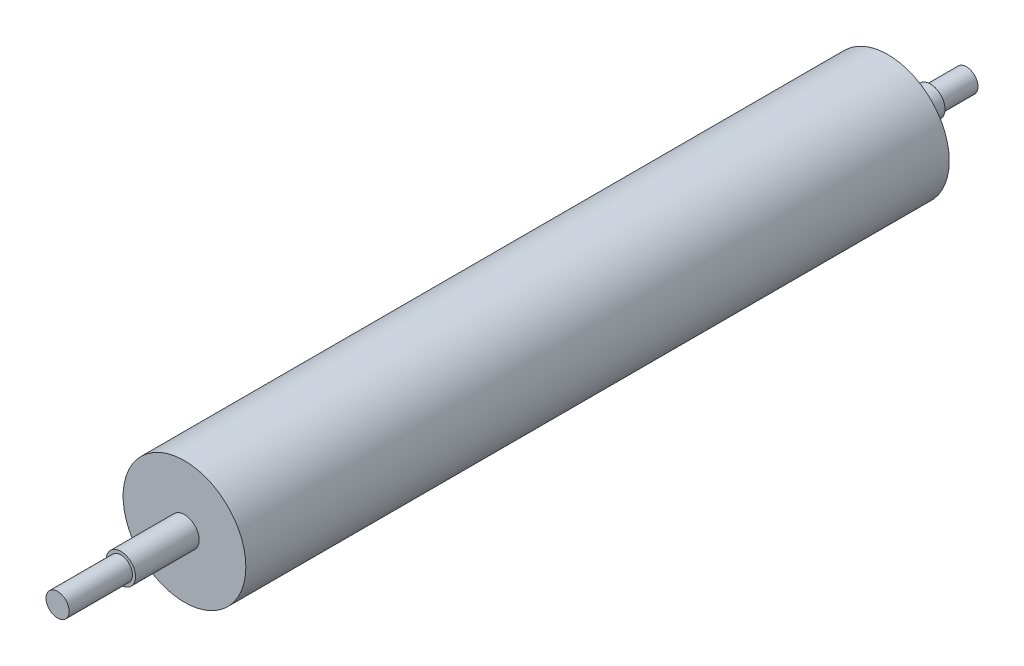
from build123d import *

# Parameters (mm, degrees)
SKETCH1_R           = 20.94
SKETCH1_R_2         = 5
SKETCH1_R_3         = 3.95
BOSS_EXTRUDE1_DEPTH = 240
SKETCH1_3_R         = 5
BOSS_EXTRUDE2_DEPTH = 14.5
BOSS_EXTRUDE3_START = -14.5
SKETCH1_4_R         = 3.95
BOSS_EXTRUDE3_DEPTH = 12.3
BOSS_EXTRUDE4_START = 261.7
SKETCH1_5_R         = 5
SKETCH1_5_R_2       = 3.95
BOSS_EXTRUDE4_DEPTH = 21.7
BOSS_EXTRUDE5_START = 283.3
SKETCH1_6_R         = 3.95
BOSS_EXTRUDE5_DEPTH = 21.6


with BuildPart() as part:
    # Sketch1 → Boss-Extrude1 (new body)
    # profile 1 of 3: a face of its own
    with BuildSketch(Plane.XY):
        Circle(SKETCH1_R)
        Circle(SKETCH1_R_2, mode=Mode.SUBTRACT)
    # profile 2 of 3: a face of its own
    with BuildSketch(Plane.XY):
        Circle(SKETCH1_R_2)
        Circle(SKETCH1_R_3, mode=Mode.SUBTRACT)
    # profile 3 of 3: a face of its own
    with BuildSketch(Plane.XY):
        Circle(SKETCH1_R_3)
    extrude(amount=BOSS_EXTRUDE1_DEPTH)

    # Sketch1<3> → Boss-Extrude2 (add)
    with BuildSketch(Plane.XY):
        Circle(SKETCH1_3_R)
    extrude(amount=-BOSS_EXTRUDE2_DEPTH)

    # Sketch1<4> → Boss-Extrude3 (add)
    with BuildSketch(Plane.XY.offset(BOSS_EXTRUDE3_START)):
        Circle(SKETCH1_4_R)
    extrude(amount=-BOSS_EXTRUDE3_DEPTH)

    # Sketch1<5> → Boss-Extrude4 (add)
    # profile 1 of 2: a face of its own
    with BuildSketch(Plane.XY.offset(BOSS_EXTRUDE4_START)):
        Circle(SKETCH1_5_R)
        Circle(SKETCH1_5_R_2, mode=Mode.SUBTRACT)
    # profile 2 of 2: a face of its own
    with BuildSketch(Plane.XY.offset(BOSS_EXTRUDE4_START)):
        Circle(SKETCH1_5_R_2)
    extrude(amount=-BOSS_EXTRUDE4_DEPTH)

    # Sketch1<6> → Boss-Extrude5 (add)
    with BuildSketch(Plane.XY.offset(BOSS_EXTRUDE5_START)):
        Circle(SKETCH1_6_R)
    extrude(amount=-BOSS_EXTRUDE5_DEPTH)


solid = part.part
